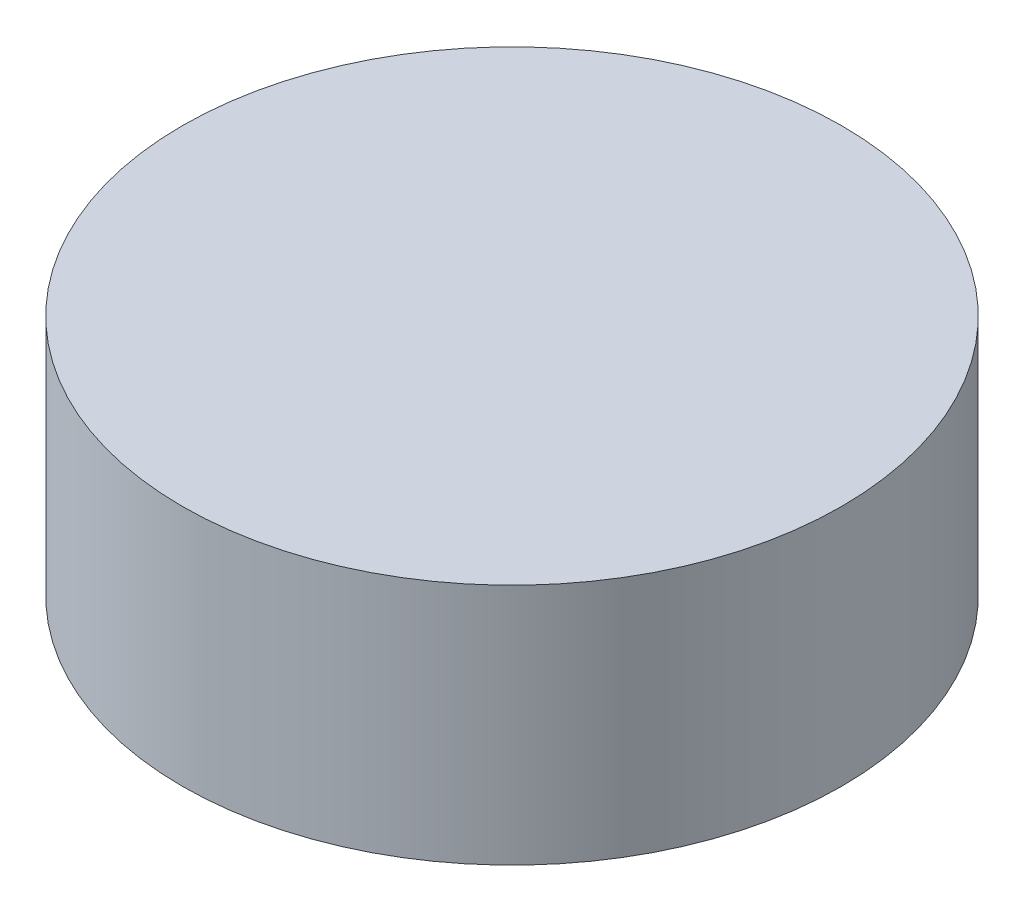
from build123d import *

# Parameters (mm, degrees)
SKETCH_1_R      = 13.6
EXTRUDE_1_DEPTH = 10


with BuildPart() as part:
    # 草图1 → 凸台-拉伸1 (new body)
    with BuildSketch(Plane(origin=(0, 0, 0), x_dir=(1, 0, 0), z_dir=(0, 1, 0))):
        with Locations(Location((0, 0, 0), (0, 0, 270))):
            Circle(SKETCH_1_R)
    extrude(amount=EXTRUDE_1_DEPTH)


solid = part.part
